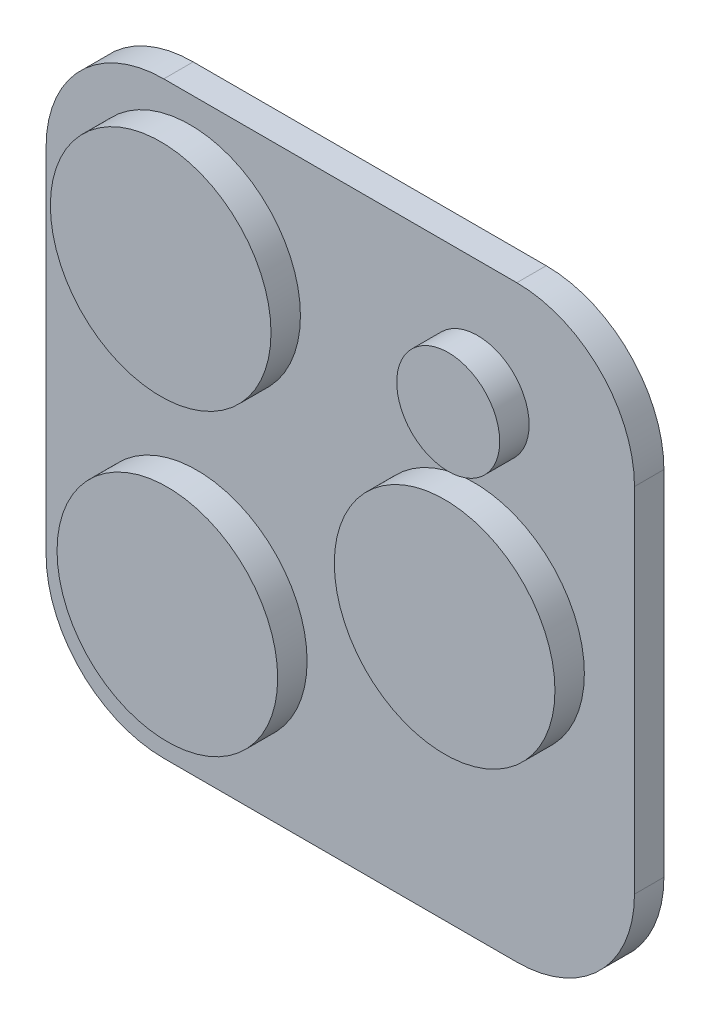
from build123d import *

# Parameters (mm, degrees)
EXTRUDE_1_DEPTH = 2
SKETCH_2_R      = 7.5
SKETCH_2_R_2    = 3.5
EXTRUDE_2_DEPTH = 2


with BuildPart() as part:
    # 草图1 → 凸台-拉伸1 (new body)
    with BuildSketch(Plane.XY):
        with BuildLine():
            Line((-34.262996942, 15.840978593), (-10.262996942, 15.840978593))
            ThreePointArc((-10.262996942, 15.840978593), (-4.606142692, 13.497832843), (-2.262996942, 7.840978593))
            Line((-2.262996942, 7.840978593), (-2.262996942, -16.159021407))
            ThreePointArc((-2.262996942, -16.159021407), (-4.606142692, -21.815875656), (-10.262996942, -24.159021407))
            Line((-10.262996942, -24.159021407), (-34.262996942, -24.159021407))
            ThreePointArc((-34.262996942, -24.159021407), (-39.919851191, -21.815875656), (-42.262996942, -16.159021407))
            Line((-42.262996942, -16.159021407), (-42.262996942, 7.840978593))
            ThreePointArc((-42.262996942, 7.840978593), (-39.919851191, 13.497832843), (-34.262996942, 15.840978593))
        make_face()
    extrude(amount=EXTRUDE_1_DEPTH)

    # 草图2 → 凸台-拉伸2 (add)
    with BuildSketch(Plane.XY.offset(2)):
        with Locations((-32.472843906, 6.539501993)):
            Circle(SKETCH_2_R)
        with Locations((-32.01907293, -13.566042797)):
            Circle(SKETCH_2_R)
        with Locations((-13.170124689, -4.874583331)):
            Circle(SKETCH_2_R)
        with Locations((-12.925786471, 7.900814922)):
            Circle(SKETCH_2_R_2)
    extrude(amount=EXTRUDE_2_DEPTH)


solid = part.part
